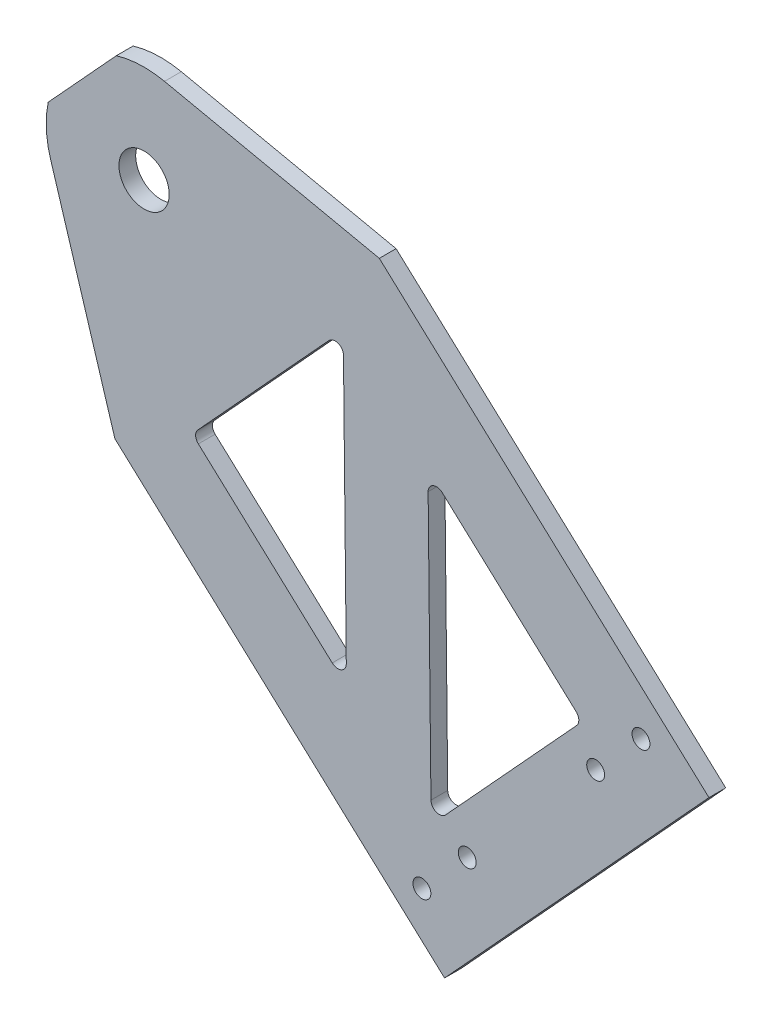
from build123d import *

# Parameters (mm, degrees)
SKETCH_1_R         = 4.5
SKETCH_1_R_2       = 1.6
EXTRUDE_1_DEPTH    = 3
CUT_EXTRUDE1_DEPTH = 3


with BuildPart() as part:
    # 草图1 → 凸台-拉伸1 (new body)
    with BuildSketch(Plane.XY):
        Polygon((-329.573940975, -130.885149725), (-282.274763971, -79.282941877), (-355.992203754, -11.712689014), (-384.249742283, -12.942126399), (-404.520818142, -35.057358334), (-403.291380758, -63.314896863), align=None)
        with Locations((-383.327664245, -34.135280295)):
            Circle(SKETCH_1_R, mode=Mode.SUBTRACT)
        with Locations((-333.628644179, -119.029375523)):
            Circle(SKETCH_1_R_2, mode=Mode.SUBTRACT)
        with Locations((-325.520213836, -110.183282749)):
            Circle(SKETCH_1_R_2, mode=Mode.SUBTRACT)
        with Locations((-302.546327862, -85.119353223)):
            Circle(SKETCH_1_R_2, mode=Mode.SUBTRACT)
        with Locations((-294.437897519, -76.273260449)):
            Circle(SKETCH_1_R_2, mode=Mode.SUBTRACT)
    extrude(amount=EXTRUDE_1_DEPTH)

    # Sketch1 → Cut-Extrude1 (cut)
    with BuildSketch(Plane.XY.offset(3)):
        with BuildLine():
            Line((-400.059680241, -39.262622756), (-388.547892801, -76.828947435))
            Line((-388.547892801, -76.828947435), (-464.128258323, -22.526868134))
            Line((-464.128258323, -22.526868134), (-423.376063206, 22.684533744))
            Line((-423.376063206, 22.684533744), (-334.935129122, 6.829576373))
            Line((-334.935129122, 6.829576373), (-341.248715798, -25.226739587))
            Line((-341.248715798, -25.226739587), (-379.672909098, -17.021170187))
            ThreePointArc((-379.672909098, -17.021170187), (-396.228216207, -22.310486045), (-400.059680241, -39.262622756))
        make_face()
        with BuildLine():
            Line((-373.620721286, -70.163397904), (-349.668317732, -92.118446391))
            ThreePointArc((-349.668317732, -92.118446391), (-348.043488399, -92.382481208), (-347.154848014, -90.996803392))
            Line((-347.154848014, -90.996803392), (-347.658183177, -43.459413358))
            ThreePointArc((-347.658183177, -43.459413358), (-348.621743848, -42.074465348), (-350.263860698, -42.461740967))
            Line((-350.263860698, -42.461740967), (-373.71292909, -68.044082514))
            ThreePointArc((-373.71292909, -68.044082514), (-374.105749776, -69.12283707), (-373.620721286, -70.163397904))
        make_face()
        with BuildLine():
            Line((-330.000431814, -55.885012577), (-306.04802826, -77.840061064))
            ThreePointArc((-306.04802826, -77.840061064), (-305.56299977, -78.880621898), (-305.955820457, -79.959376454))
            Line((-305.955820457, -79.959376454), (-329.404888848, -105.541718001))
            ThreePointArc((-329.404888848, -105.541718001), (-331.047005699, -105.92899362), (-332.010566369, -104.544045611))
            Line((-332.010566369, -104.544045611), (-332.513901532, -57.006655576))
            ThreePointArc((-332.513901532, -57.006655576), (-331.625261147, -55.62097776), (-330.000431814, -55.885012577))
        make_face()
    extrude(amount=-CUT_EXTRUDE1_DEPTH, mode=Mode.SUBTRACT)


solid = part.part
